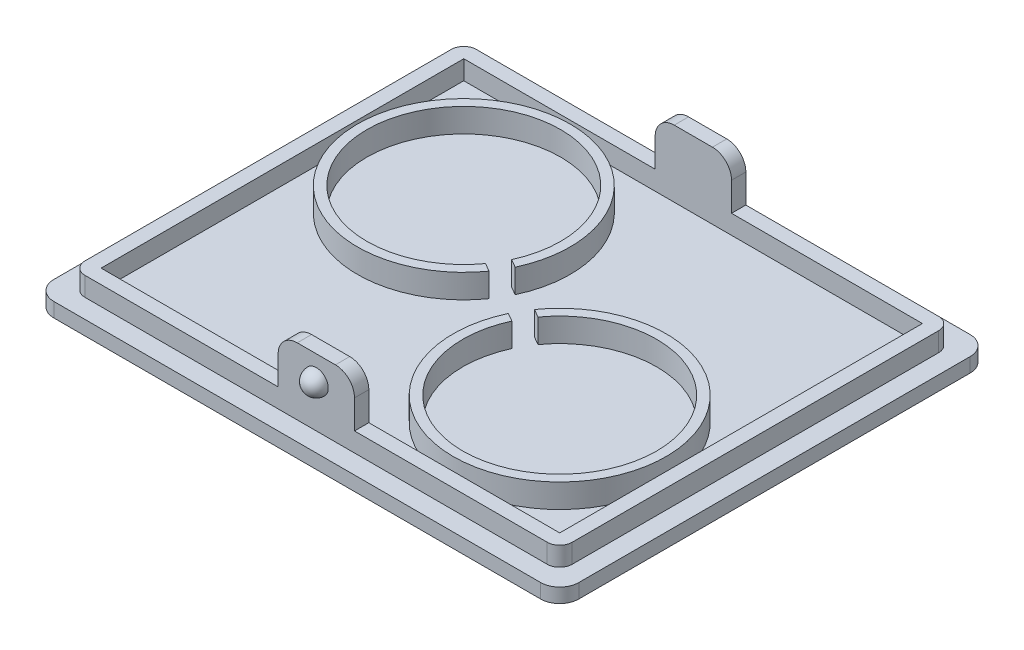
from build123d import *

# Parameters (mm, degrees)
SALIENTE_EXTRUIR1_DEPTH = 1.5
CROQUIS9_W              = 48.051342352
CROQUIS9_H              = 38
SALIENTE_EXTRUIR7_DEPTH = 2
CROQUIS10_W             = 8
CROQUIS10_H             = 1.5
SALIENTE_EXTRUIR8_DEPTH = 5
REDONDEO1_R             = 2
REVOLUCI_N1_ANGLE       = 180
CROQUIS14_R             = 11.15
CROQUIS14_R_2           = 10.15
SALIENTE_EXTRUIR9_DEPTH = 2.5
CORTAR_EXTRUIR4_DEPTH   = 2.5


with BuildPart() as part:
    # Croquis1 → Saliente-Extruir1 (new body)
    with BuildSketch(Plane(origin=(0, 0, 0), x_dir=(1, 0, 0), z_dir=(0, 1, 0))):
        with BuildLine():
            Line((-25.5, -22.5), (25.5, -22.5))
            ThreePointArc((25.5, -22.5), (26.914213562, -21.914213562), (27.5, -20.5))
            Line((27.5, -20.5), (27.5, 20.5))
            ThreePointArc((27.5, 20.5), (26.914213562, 21.914213562), (25.5, 22.5))
            Line((25.5, 22.5), (-25.5, 22.5))
            ThreePointArc((-25.5, 22.5), (-26.914213562, 21.914213562), (-27.5, 20.5))
            Line((-27.5, 20.5), (-27.5, -20.5))
            ThreePointArc((-27.5, -20.5), (-26.914213562, -21.914213562), (-25.5, -22.5))
        make_face()
    extrude(amount=SALIENTE_EXTRUIR1_DEPTH)

    # Croquis9 → Saliente-Extruir7 (add)
    with BuildSketch(Plane(origin=(0, 1.5, 0), x_dir=(1, 0, 0), z_dir=(0, 1, 0))):
        with BuildLine():
            Line((-24.243818065, 20.5), (24.192475714, 20.5))
            ThreePointArc((24.192475714, 20.5), (25.117035003, 20.117035003), (25.5, 19.192475714))
            Line((25.5, 19.192475714), (25.5, -19.192475714))
            ThreePointArc((25.5, -19.192475714), (25.117035003, -20.117035003), (24.192475714, -20.5))
            Line((24.192475714, -20.5), (-24.243818065, -20.5))
            ThreePointArc((-24.243818065, -20.5), (-25.168377355, -20.117035003), (-25.551342352, -19.192475714))
            Line((-25.551342352, -19.192475714), (-25.551342352, 19.192475714))
            ThreePointArc((-25.551342352, 19.192475714), (-25.168377355, 20.117035003), (-24.243818065, 20.5))
        make_face()
        with Locations((-0.025671176, 0)):
            Rectangle(CROQUIS9_W, CROQUIS9_H, mode=Mode.SUBTRACT)
    extrude(amount=SALIENTE_EXTRUIR7_DEPTH)

    # Croquis10 → Saliente-Extruir8 (add)
    with BuildSketch(Plane(origin=(0, 3.5, 0), x_dir=(1, 0, 0), z_dir=(0, 1, 0))):
        with Locations((0, 19.75)):
            Rectangle(CROQUIS10_W, CROQUIS10_H)
        with Locations((0, -19.75)):
            Rectangle(CROQUIS10_W, CROQUIS10_H)
    extrude(amount=SALIENTE_EXTRUIR8_DEPTH)

    # Redondeo1
    redondeo1_edges = [part.edges().sort_by_distance(p)[0] for p in [
        (-4, 8.5, -19.75),
        (4, 8.5, -19.75),
        (4, 8.5, 19.75),
        (-4, 8.5, 19.75),
    ]]
    fillet(redondeo1_edges, radius=REDONDEO1_R)

    # Croquis13 → Revolución1 (revolve)
    with BuildSketch(Plane.XY.offset(20.5)):
        with BuildLine():
            Line((0, 7.25), (0, 4.75))
            ThreePointArc((0, 4.75), (-1.25, 6), (0, 7.25))
        make_face()
    revoluci_n1 = revolve(axis=Axis((0, -1000, 20.5), (0, 1, 0)), revolution_arc=REVOLUCI_N1_ANGLE)

    # Simetría1: Revolución1 across plane
    add(revoluci_n1.mirror(Plane.XY))

    # Croquis14 → Saliente-Extruir9 (add)
    # profile 1 of 2: a face of its own
    with BuildSketch(Plane(origin=(0, 1.5, 0), x_dir=(1, 0, 0), z_dir=(0, 1, 0))):
        with Locations(Location((11.998657648, -7, 0), (0, 0, 270))):
            Circle(CROQUIS14_R)
        with Locations(Location((11.998657648, -7, 0), (0, 0, 270))):
            Circle(CROQUIS14_R_2, mode=Mode.SUBTRACT)
    # profile 2 of 2: a face of its own
    with BuildSketch(Plane(origin=(0, 1.5, 0), x_dir=(1, 0, 0), z_dir=(0, 1, 0))):
        with Locations(Location((-12.05, 7, 0), (0, 0, 270))):
            Circle(CROQUIS14_R)
        with Locations(Location((-12.05, 7, 0), (0, 0, 270))):
            Circle(CROQUIS14_R_2, mode=Mode.SUBTRACT)
    extrude(amount=SALIENTE_EXTRUIR9_DEPTH)

    # Croquis15 → Cortar-Extruir4 (cut)
    with BuildSketch(Plane(origin=(0, 1.5, 0), x_dir=(1, 0, 0), z_dir=(0, 1, 0))):
        Polygon((-12.553109789, 6.135777494), (11.495547859, -7.864222506), (12.501767438, -6.135777494), (-11.546890211, 7.864222506), align=None)
    extrude(amount=CORTAR_EXTRUIR4_DEPTH, mode=Mode.SUBTRACT)


solid = part.part
